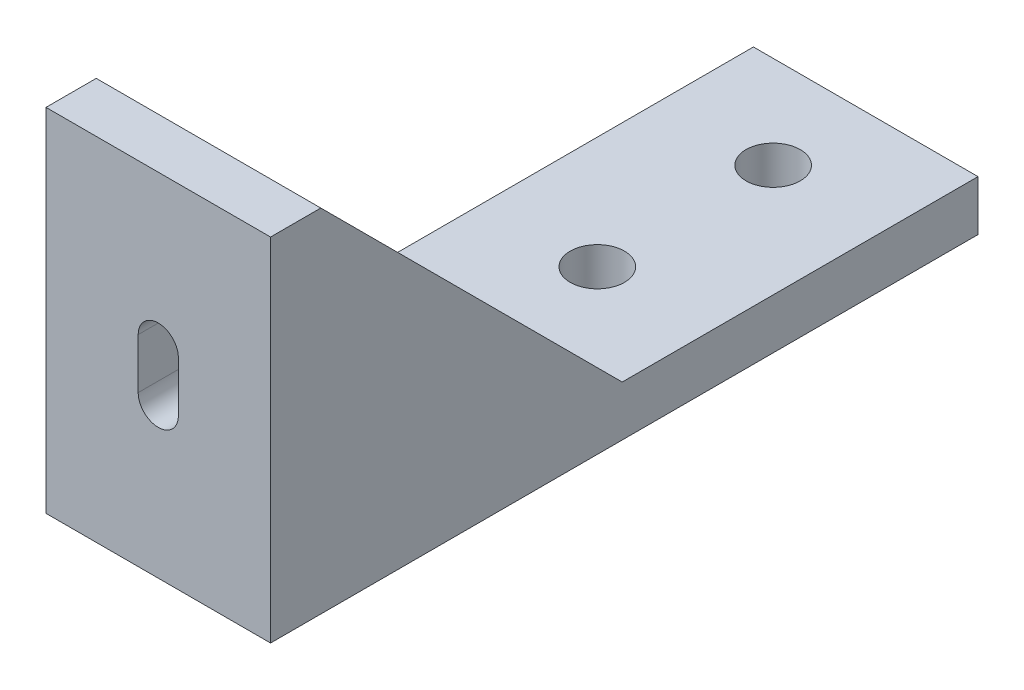
from build123d import *

# Parameters (mm, degrees)
SKETCH1_R           = 2.7
BOSS_EXTRUDE1_DEPTH = 5
SKETCH2_W           = 22.352
SKETCH2_H           = 5
BOSS_EXTRUDE2_DEPTH = 30
CUT_EXTRUDE1_DEPTH  = 5
BOSS_EXTRUDE3_DEPTH = 2
BOSS_EXTRUDE4_DEPTH = 2
SKETCH7_W           = 22.352
SKETCH7_H           = 36.907486172
BOSS_EXTRUDE5_DEPTH = 5
SKETCH8_R           = 2.7
CUT_EXTRUDE2_DEPTH  = 5
SKETCH9_W           = 22.352
SKETCH9_H           = 5
CUT_EXTRUDE3_DEPTH  = 15


with BuildPart() as part:
    # Sketch1 → Boss-Extrude1 (new body)
    with BuildSketch(Plane(origin=(0, 0, 0), x_dir=(1, 0, 0), z_dir=(0, 1, 0))):
        Polygon((0.666305019, -42.873782933), (-10.509694981, -42.873782933), (-10.509694981, -15.816806264), (-10.509694981, 42.540630423), (11.842305019, 42.540630423), (11.842305019, -42.873782933), align=None)
        with Locations(Location((0.666305019, 31.319617067, 0), (0, 0, 270))):
            Circle(SKETCH1_R, mode=Mode.SUBTRACT)
        with Locations(Location((0.666305019, 14.250817067, 0), (0, 0, 270))):
            Circle(SKETCH1_R, mode=Mode.SUBTRACT)
    extrude(amount=BOSS_EXTRUDE1_DEPTH)

    # Sketch2 → Boss-Extrude2 (add)
    with BuildSketch(Plane(origin=(0, 5, 0), x_dir=(1, 0, 0), z_dir=(0, 1, 0))):
        with Locations((0.666305019, -40.373782933)):
            Rectangle(SKETCH2_W, SKETCH2_H)
    extrude(amount=BOSS_EXTRUDE2_DEPTH)

    # Sketch3 → Cut-Extrude1 (cut)
    with BuildSketch(Plane(origin=(0, 0, 37.873782933), x_dir=(-1, 0, 0), z_dir=(0, 0, -1))):
        with BuildLine():
            Line((-2.666305019, 20), (-2.666305019, 15))
            ThreePointArc((-2.666305019, 15), (-0.666305019, 13), (1.333694981, 15))
            Line((1.333694981, 15), (1.333694981, 20))
            ThreePointArc((1.333694981, 20), (-0.666305019, 22), (-2.666305019, 20))
        make_face()
    extrude(amount=-CUT_EXTRUDE1_DEPTH, mode=Mode.SUBTRACT)

    # Sketch4 → Boss-Extrude3 (add)
    with BuildSketch(Plane(origin=(11.842305019, 0, 0), x_dir=(0, 0, -1), z_dir=(1, 0, 0))):
        Polygon((-37.873782933, 35), (-37.873782933, 5), (-7.873782933, 5), align=None)
    extrude(amount=-BOSS_EXTRUDE3_DEPTH)

    # Sketch5 → Boss-Extrude4 (add)
    with BuildSketch(Plane.ZY.offset(10.509694981)):
        Polygon((37.873782933, 35), (7.873782933, 5), (37.873782933, 5), align=None)
    extrude(amount=-BOSS_EXTRUDE4_DEPTH)

    # Sketch7 → Boss-Extrude5 (add)
    with BuildSketch(Plane.XZ):
        with Locations((0.666305019, -24.086887337)):
            Rectangle(SKETCH7_W, SKETCH7_H)
    extrude(amount=-BOSS_EXTRUDE5_DEPTH)

    # Sketch8 → Cut-Extrude2 (cut)
    with BuildSketch(Plane.XZ):
        with Locations(Location((0.666305019, -0.826217067, 0), (0, 0, 270))):
            Circle(SKETCH8_R)
        with Locations(Location((0.666305019, -18.326217067, 0), (0, 0, 270))):
            Circle(SKETCH8_R)
    extrude(amount=-CUT_EXTRUDE2_DEPTH, mode=Mode.SUBTRACT)

    # Sketch9 → Cut-Extrude3 (cut)
    with BuildSketch(Plane(origin=(0, 0, -42.540630423), x_dir=(-1, 0, 0), z_dir=(0, 0, -1))):
        with Locations((-0.666305019, 2.5)):
            Rectangle(SKETCH9_W, SKETCH9_H)
    extrude(amount=-CUT_EXTRUDE3_DEPTH, mode=Mode.SUBTRACT)


solid = part.part
